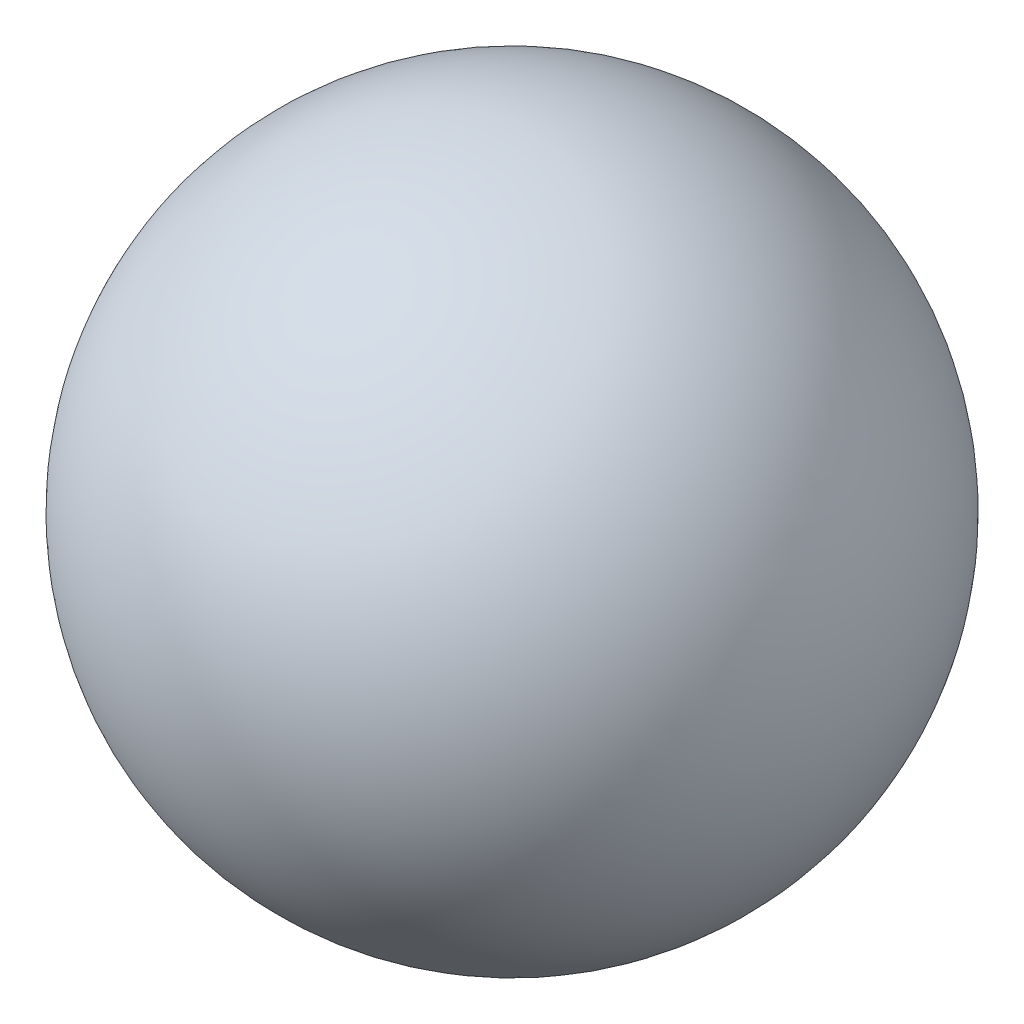
from build123d import *


with BuildPart() as part:
    # Esquisse2 → Base-Révolution (revolve)
    with BuildSketch(Plane.XY):
        with BuildLine():
            Line((2.66665, 0), (-2.66665, 0))
            ThreePointArc((-2.66665, 0), (0, 2.66665), (2.66665, 0))
        make_face()
    revolve(axis=Axis((2.66665, 0, 0), (-1, 0, 0)))


solid = part.part
